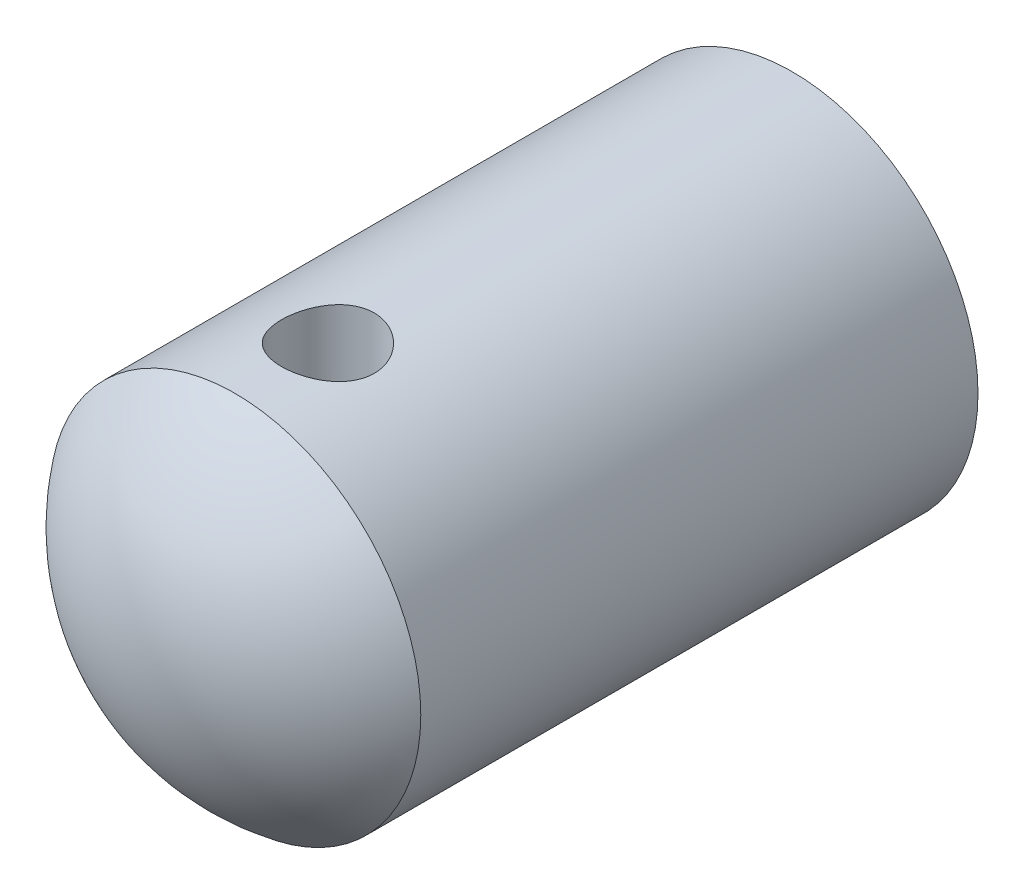
from build123d import *

# Parameters (mm, degrees)
IZIM1_R                     = 40
Y_KSEKLIK_EKSTR_ZYON1_DEPTH = 120
IZIM2_R                     = 10
KES_EKSTR_ZYON1_DEPTH       = 30
KUBBE1_FACE_RADIUS          = 40
KUBBE1_HEIGHT               = 20


with BuildPart() as part:
    # Çizim1 → Yükseklik-Ekstrüzyon1 (new body)
    with BuildSketch(Plane.XY):
        Circle(IZIM1_R)
    extrude(amount=Y_KSEKLIK_EKSTR_ZYON1_DEPTH)

    # Çizim2 → Kes-Ekstrüzyon1 (cut)
    with BuildSketch(Plane(origin=(0, 20, 0), x_dir=(1, 0, 0), z_dir=(0, 1, 0))):
        with Locations(Location((0, -100, 0), (0, 0, 90))):
            Circle(IZIM2_R)
    kes_ekstr_zyon1 = extrude(amount=KES_EKSTR_ZYON1_DEPTH, mode=Mode.SUBTRACT)

    # Aynalama1: Kes-Ekstrüzyon1 across plane
    add(kes_ekstr_zyon1.mirror(Plane.ZX), mode=Mode.SUBTRACT)

    # Kubbe1: a dome of height H over a round flat face of radius A is a cap of a sphere of radius (A * A + H * H) / (2 * H)
    kubbe1_r = (KUBBE1_FACE_RADIUS * KUBBE1_FACE_RADIUS + KUBBE1_HEIGHT * KUBBE1_HEIGHT) / (2 * KUBBE1_HEIGHT)
    kubbe1_base = Plane((0, 0, 120), z_dir=(0, 0, 1))
    with Locations(kubbe1_base.offset(KUBBE1_HEIGHT - kubbe1_r)):
        kubbe1_ball = Sphere(kubbe1_r, mode=Mode.PRIVATE)
    add(split(kubbe1_ball, bisect_by=kubbe1_base, keep=Keep.TOP, mode=Mode.PRIVATE))


solid = part.part
